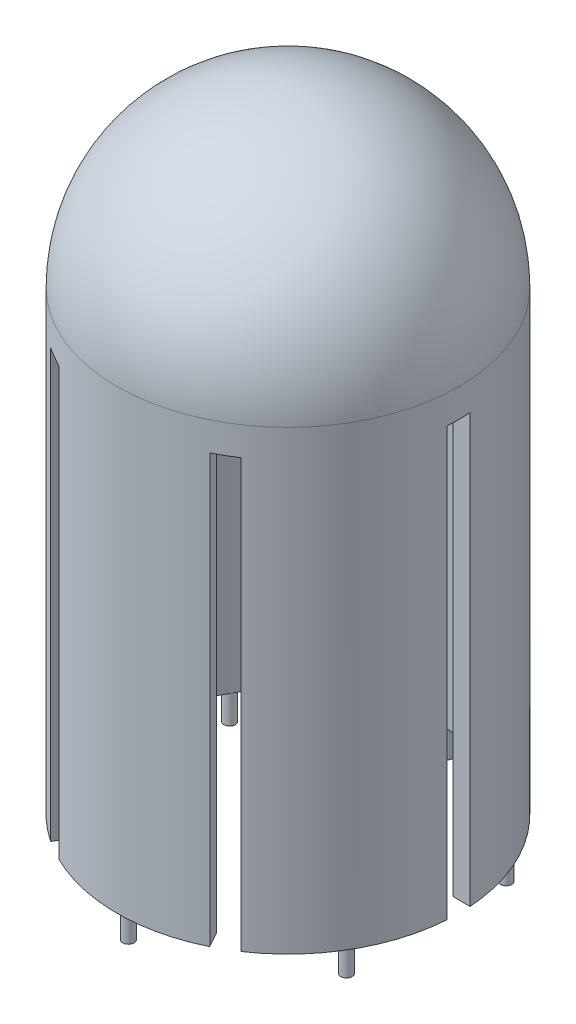
from build123d import *

# Parameters (mm, degrees)
SKETCH1_R           = 38.1
BOSS_EXTRUDE1_DEPTH = 101.6
SKETCH3_R           = 34.29
CUT_EXTRUDE2_DEPTH  = 101.6
SKETCH4_R           = 1.27
BOSS_EXTRUDE2_DEPTH = 6.35
CUT_EXTRUDE5_DEPTH  = 95.25


with BuildPart() as part:
    # Sketch1 → Boss-Extrude1 (new body)
    with BuildSketch(Plane(origin=(0, 0, 0), x_dir=(1, 0, 0), z_dir=(0, 1, 0))):
        with Locations(Location((0, 0, 0), (0, 0, 270))):
            Circle(SKETCH1_R)
    extrude(amount=BOSS_EXTRUDE1_DEPTH)

    # Sketch2 → Revolve1 (revolve)
    with BuildSketch(Plane(origin=(0, 0, 0), x_dir=(0, 0, -1), z_dir=(1, 0, 0))):
        with BuildLine():
            Line((38.1, 101.6), (34.29, 101.6))
            ThreePointArc((34.29, 101.6), (24.246691527, 125.846691527), (0, 135.89))
            Line((0, 135.89), (0, 139.7))
            ThreePointArc((0, 139.7), (26.940768363, 128.540768363), (38.1, 101.6))
        make_face()
    revolve(axis=Axis((0, 0, 0), (0, 1, 0)))

    # Sketch3 → Cut-Extrude2 (cut)
    with BuildSketch(Plane.XZ):
        with Locations(Location((0, 0, 0), (0, 0, 270))):
            Circle(SKETCH3_R)
    extrude(amount=-CUT_EXTRUDE2_DEPTH, mode=Mode.SUBTRACT)

    # Sketch4 → Boss-Extrude2 (add)
    with BuildSketch(Plane(origin=(0, 0, 0), x_dir=(1, 0, 0), z_dir=(0, 1, 0))):
        with Locations(Location((0, -35.56, 0), (0, 0, 270))):
            Circle(SKETCH4_R)
        with Locations(Location((-30.795863359, -17.78, 0), (0, 0, 270))):
            Circle(SKETCH4_R)
        with Locations(Location((-30.795863359, 17.78, 0), (0, 0, 270))):
            Circle(SKETCH4_R)
        with Locations(Location((0, 35.56, 0), (0, 0, 270))):
            Circle(SKETCH4_R)
        with Locations(Location((30.795863359, 17.78, 0), (0, 0, 270))):
            Circle(SKETCH4_R)
        with Locations(Location((30.795863359, -17.78, 0), (0, 0, 270))):
            Circle(SKETCH4_R)
    extrude(amount=-BOSS_EXTRUDE2_DEPTH)

    # Sketch5 → Cut-Extrude5 (cut)
    with BuildSketch(Plane.XZ):
        Polygon((-21.563277102, 32.196696757), (-17.195234057, 34.790265717), (-14.171362758, 29.697515071), (-18.539405803, 27.103946111), align=None)
        Polygon((14.203002973, 29.607569452), (18.633121102, 27.12151769), (21.531636887, 32.286642376), (17.101518758, 34.772694138), align=None)
        Polygon((32.742408776, 2.503623341), (32.804483859, -2.575997381), (38.726870944, -2.503623341), (38.66479586, 2.575997381), align=None)
        Polygon((18.539405803, -27.103946111), (14.171362758, -29.697515071), (17.195234057, -34.790265717), (21.563277102, -32.196696757), align=None)
        Polygon((-14.203002973, -29.607569452), (-18.633121102, -27.12151769), (-21.531636887, -32.286642376), (-17.101518758, -34.772694138), align=None)
        Polygon((-32.742408776, -2.503623341), (-32.804483859, 2.575997381), (-38.726870944, 2.503623341), (-38.66479586, -2.575997381), align=None)
    extrude(amount=-CUT_EXTRUDE5_DEPTH, mode=Mode.SUBTRACT)


solid = part.part
